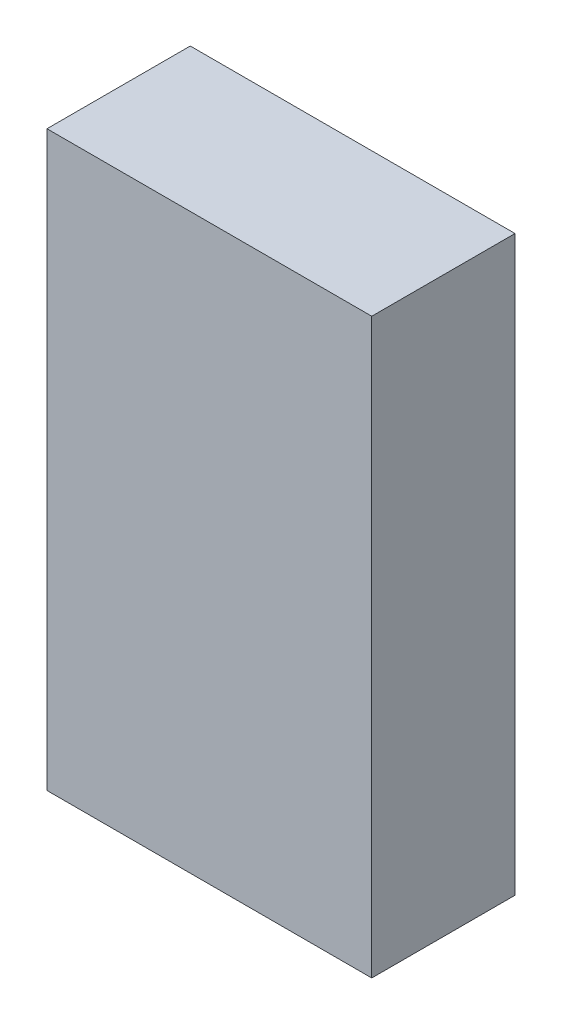
from build123d import *

# Parameters (mm, degrees)
CROQUIS1_W              = 17
CROQUIS1_H              = 30
SALIENTE_EXTRUIR1_DEPTH = 7.5


with BuildPart() as part:
    # Croquis1 → Saliente-Extruir1 (new body)
    with BuildSketch(Plane.XY):
        Rectangle(CROQUIS1_W, CROQUIS1_H)
    extrude(amount=SALIENTE_EXTRUIR1_DEPTH)


solid = part.part
